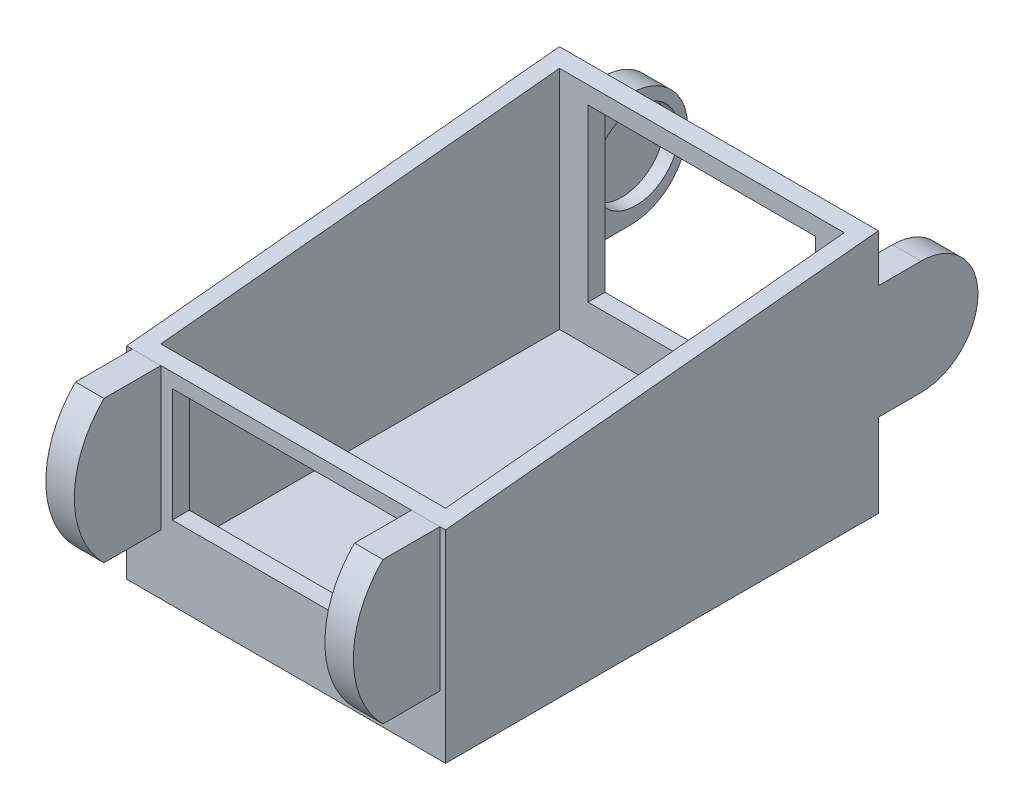
from build123d import *

# Parameters (mm, degrees)
SKETCH1_W           = 50
SKETCH1_H           = 70
BOSS_EXTRUDE1_DEPTH = 40
SHELL1_T            = 3
BOSS_EXTRUDE2_START = -2
BOSS_EXTRUDE2_DEPTH = 5
CUT_EXTRUDE1_DEPTH  = 87.984136485
BOSS_EXTRUDE4_DEPTH = 5
SKETCH8_R           = 7.5
CUT_EXTRUDE2_DEPTH  = 2.5
SKETCH9_W           = 40
SKETCH9_H           = 30
CUT_EXTRUDE3_DEPTH  = 10
CUT_EXTRUDE4_DEPTH  = 10


with BuildPart() as part:
    # Sketch1 → Boss-Extrude1 (new body)
    with BuildSketch(Plane(origin=(0, 0, 0), x_dir=(1, 0, 0), z_dir=(0, 1, 0))):
        Rectangle(SKETCH1_W, SKETCH1_H)
    extrude(amount=BOSS_EXTRUDE1_DEPTH)

    # Shell1
    shell1_openings = [part.faces().sort_by_distance(p)[0] for p in [
        (0, 40, 0),
    ]]
    offset(amount=SHELL1_T, openings=shell1_openings, kind=Kind.INTERSECTION)

    # Sketch2 → Boss-Extrude2 (add)
    with BuildSketch(Plane.ZY.offset(-25).offset(BOSS_EXTRUDE2_START)):
        with BuildLine():
            Line((38, 32.5), (48, 32.5))
            ThreePointArc((48, 32.5), (53.2, 20), (48, 7.5))
            Line((48, 7.5), (38, 7.5))
            Line((38, 7.5), (38, 32.5))
        make_face()
    boss_extrude2 = extrude(amount=BOSS_EXTRUDE2_DEPTH)

    # Mirror1: Boss-Extrude2 across plane
    add(boss_extrude2.mirror(Plane.ZY))

    # Sketch4 → Cut-Extrude1 (cut, through all)
    with BuildSketch(Plane.ZY.offset(28)):
        Polygon((-38, 40), (38, 40), (38, 32.5), align=None)
    extrude(amount=-CUT_EXTRUDE1_DEPTH, mode=Mode.SUBTRACT)

    # Sketch7 → Boss-Extrude4 (add)
    with BuildSketch(Plane.ZY.offset(28)):
        with BuildLine():
            Line((-38, 31.635993136), (-45.5, 31.635993136))
            ThreePointArc((-45.5, 31.635993136), (-55.5, 21.635993136), (-45.5, 11.635993136))
            Line((-45.5, 11.635993136), (-38, 11.635993136))
            Line((-38, 11.635993136), (-38, 31.635993136))
        make_face()
    boss_extrude4 = extrude(amount=-BOSS_EXTRUDE4_DEPTH)

    # Mirror3: Boss-Extrude4 across plane
    add(boss_extrude4.mirror(Plane.ZY))

    # Sketch8 → Cut-Extrude2 (cut)
    with BuildSketch(Plane.ZY.offset(-23)):
        with Locations((-46.455887692, 21.635993136)):
            Circle(SKETCH8_R)
    cut_extrude2 = extrude(amount=-CUT_EXTRUDE2_DEPTH, mode=Mode.SUBTRACT)

    # Mirror4: Cut-Extrude2 across plane
    add(cut_extrude2.mirror(Plane.ZY), mode=Mode.SUBTRACT)

    # Sketch9 → Cut-Extrude3 (cut)
    with BuildSketch(Plane(origin=(0, 0, -38), x_dir=(-1, 0, 0), z_dir=(0, 0, -1))):
        with Locations((0, 21.635993136)):
            Rectangle(SKETCH9_W, SKETCH9_H)
    extrude(amount=-CUT_EXTRUDE3_DEPTH, mode=Mode.SUBTRACT)

    # 3DSketch1 → Cut-Extrude4 (cut)
    with BuildSketch(Plane(origin=(20, 10, 38), x_dir=(-0.894427190999916, 0.447213595499958, 0), z_dir=(0, 0, 1))):
        Polygon((0, 0), (35.77708764, 17.88854382), (44.72135955, 0), (8.94427191, -17.88854382), align=None)
    extrude(amount=-CUT_EXTRUDE4_DEPTH, mode=Mode.SUBTRACT)


solid = part.part
